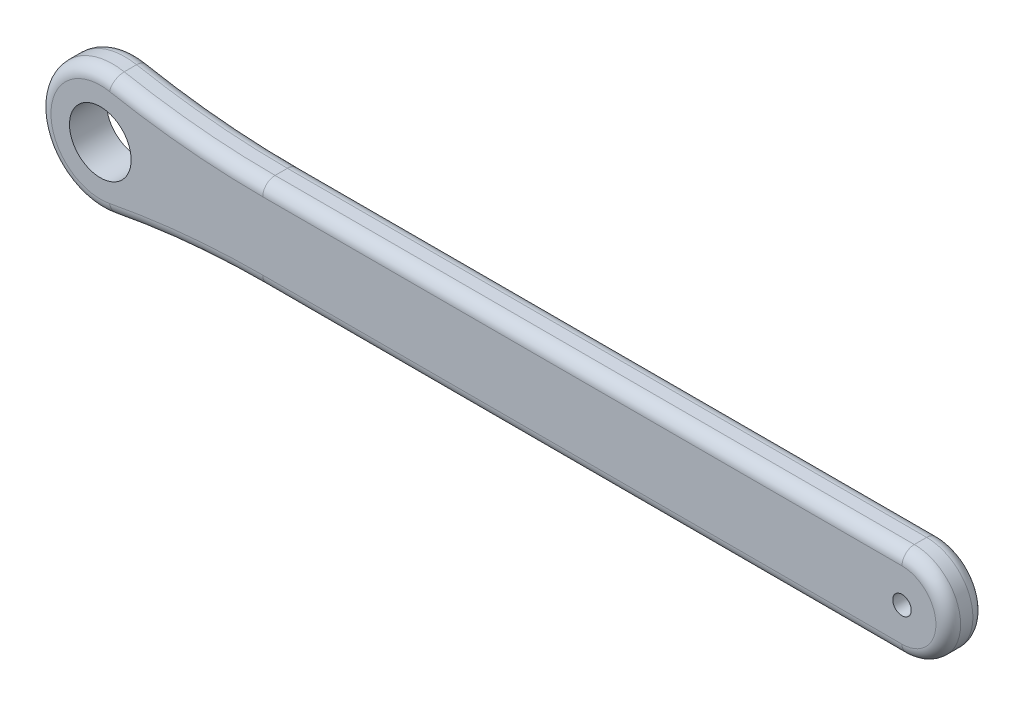
from build123d import *

# Parameters (mm, degrees)
SKETCH1_R           = 5
SKETCH1_R_2         = 1.5
BOSS_EXTRUDE1_DEPTH = 6
FILLET1_R           = 2
SKETCH2_W           = 111
SKETCH2_H           = 8
CUT_EXTRUDE1_DEPTH  = 4


with BuildPart() as part:
    # Sketch1 → Boss-Extrude1 (new body)
    with BuildSketch(Plane.XY):
        with BuildLine():
            Line((26.339134382, 7.5), (130, 7.5))
            ThreePointArc((130, 7.5), (137.5, 0), (130, -7.5))
            Line((130, -7.5), (26.339134382, -7.5))
            ThreePointArc((26.339134382, -7.5), (14.055289009, -8.081658399), (1.881366742, -9.821428571))
            ThreePointArc((1.881366742, -9.821428571), (-10, 0), (1.881366742, 9.821428571))
            ThreePointArc((1.881366742, 9.821428571), (14.055289009, 8.081658399), (26.339134382, 7.5))
        make_face()
        Circle(SKETCH1_R, mode=Mode.SUBTRACT)
        with Locations((130, 0)):
            Circle(SKETCH1_R_2, mode=Mode.SUBTRACT)
    extrude(amount=BOSS_EXTRUDE1_DEPTH)

    # Fillet1
    fillet1_edges = [part.edges().sort_by_distance(p)[0] for p in [
        (14.055289009, 8.081658399, 6),
        (-10, 0, 6),
        (14.055289009, -8.081658399, 6),
        (78.169567191, -7.5, 6),
        (137.5, 0, 6),
        (78.169567191, -7.5, 0),
        (14.055289009, -8.081658399, 0),
        (-10, 0, 0),
        (78.169567191, 7.5, 6),
        (14.055289009, 8.081658399, 0),
        (78.169567191, 7.5, 0),
        (137.5, 0, 0),
    ]]
    fillet(fillet1_edges, radius=FILLET1_R)

    # Sketch2 → Cut-Extrude1 (cut)
    with BuildSketch(Plane(origin=(0, 0, 0), x_dir=(-1, 0, 0), z_dir=(0, 0, -1))):
        with Locations((-67.5, 0)):
            Rectangle(SKETCH2_W, SKETCH2_H)
    extrude(amount=-CUT_EXTRUDE1_DEPTH, mode=Mode.SUBTRACT)


solid = part.part
